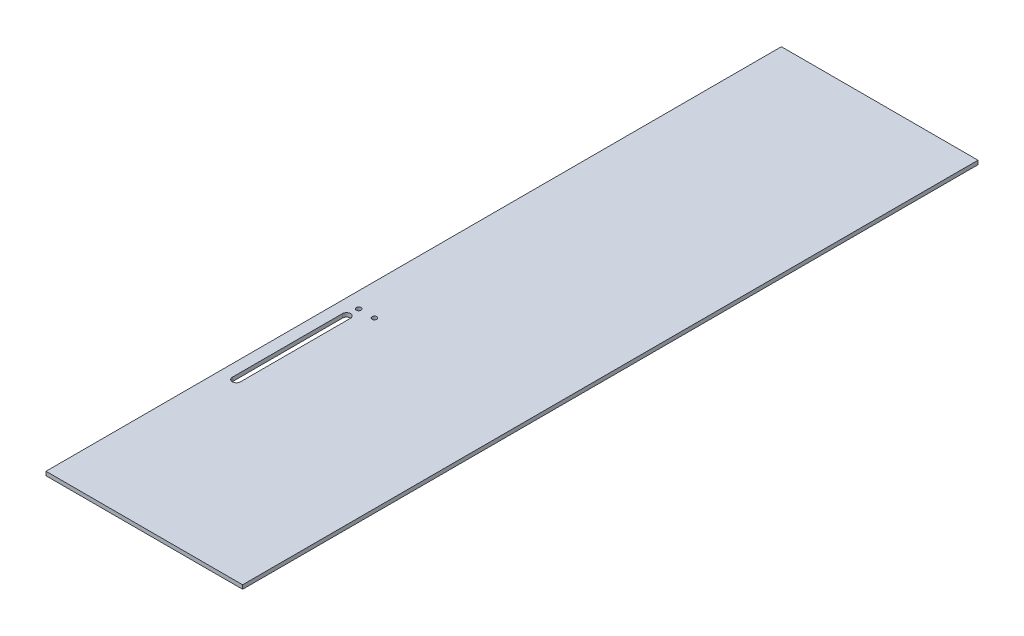
from build123d import *

# Parameters (mm, degrees)
SKETCH1_W                 = 158.75
SKETCH1_H                 = 593.725
BOSS_EXTRUDE1_DEPTH       = 3.175
F_6_CLEARANCE_HOLE1_D     = 3.7973
F_6_CLEARANCE_HOLE1_DEPTH = 12.7
F_6_CLEARANCE_HOLE1_TIP   = 1.140824014
CUT_EXTRUDE3_DEPTH        = 308.307362678


with BuildPart() as part:
    # Sketch1 → Boss-Extrude1 (new body)
    with BuildSketch(Plane(origin=(0, 0, 0), x_dir=(1, 0, 0), z_dir=(0, 1, 0))):
        Rectangle(SKETCH1_W, SKETCH1_H)
    extrude(amount=BOSS_EXTRUDE1_DEPTH)

    # #6 Clearance Hole1
    with Locations(Plane(origin=(0, 3.175, 0), x_dir=(1, 0, 0), z_dir=(0, 1, 0))):
        with Locations((-66.675, -57.099200009), (-53.975, -57.099200009)):
            Hole(F_6_CLEARANCE_HOLE1_D / 2, depth=F_6_CLEARANCE_HOLE1_DEPTH)
            with Locations((0, 0, -(F_6_CLEARANCE_HOLE1_DEPTH + F_6_CLEARANCE_HOLE1_TIP / 2))):  # 118° drill point
                Cone(0, F_6_CLEARANCE_HOLE1_D / 2, F_6_CLEARANCE_HOLE1_TIP, mode=Mode.SUBTRACT)

    # Sketch15 → Cut-Extrude3 (cut, through all)
    with BuildSketch(Plane(origin=(0, 3.175, 0), x_dir=(1, 0, 0), z_dir=(0, 1, 0))):
        with BuildLine():
            Line((-63.4111, -66.941700009), (-63.4111, -155.841700009))
            ThreePointArc((-63.4111, -155.841700009), (-66.675, -159.105600009), (-69.9389, -155.841700009))
            Line((-69.9389, -155.841700009), (-69.9389, -66.941700009))
            ThreePointArc((-69.9389, -66.941700009), (-66.675, -63.677800009), (-63.4111, -66.941700009))
        make_face()
    extrude(amount=-CUT_EXTRUDE3_DEPTH, mode=Mode.SUBTRACT)


solid = part.part
